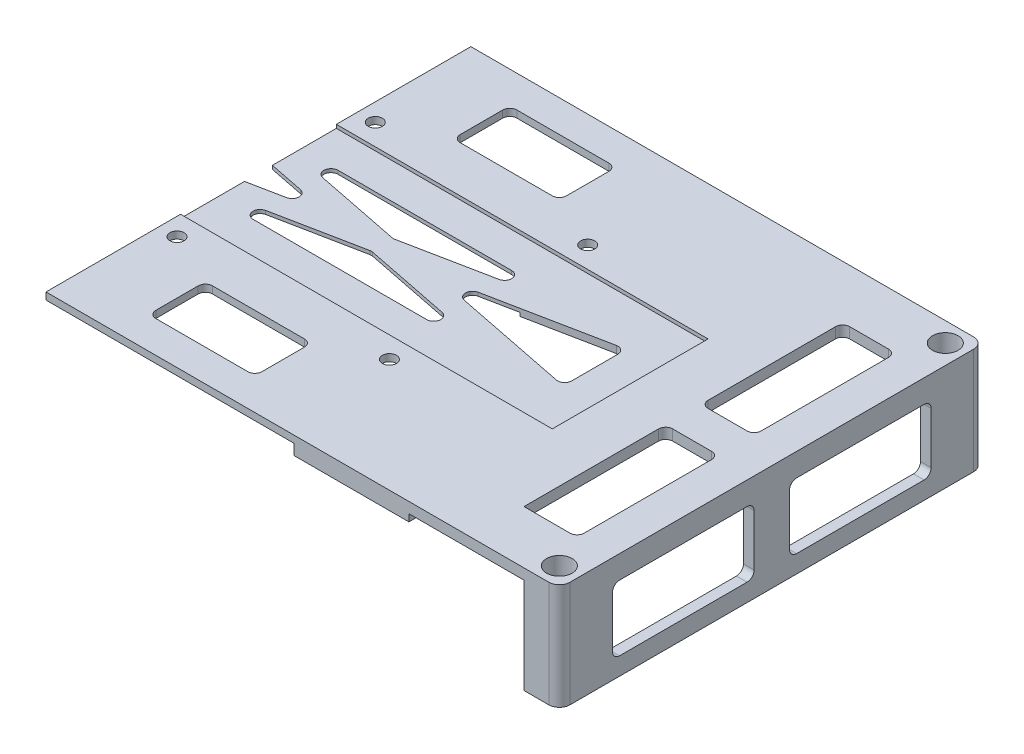
from build123d import *

# Parameters (mm, degrees)
SKETCH_8_W                = 220
SKETCH_8_H                = 120
EXTRUDE_6_DEPTH           = 3
SKETCH_10_W               = 10
SKETCH_10_H               = 120
EXTRUDE_7_DEPTH           = 27
CUT_EXTRUDE_1_DEPTH       = 129.175660716
CUT_EXTRUDE_1_DEPTH_BACK  = 129.175660716
SKETCH_9_R                = 2.05
SKETCH_11_R               = 3.6
CUT_EXTRUDE_2_DEPTH       = 22
CUT_EXTRUDE_4_DEPTH       = 129.175660716
CUT_EXTRUDE_4_DEPTH_BACK  = 129.175660716
SKETCH_13_W               = 40
SKETCH_13_H               = 18.5
SKETCH_14_W               = 140
SKETCH_14_H               = 44
CUT_EXTRUDE_7_DEPTH       = 1
SKETCH_15_W               = 15
SKETCH_15_H               = 80
SKETCH_15_H_2             = 40
SKETCH_15_W_2             = 30
SKETCH_15_H_3             = 16
CUT_EXTRUDE_8_DEPTH       = 129.840987267
SKETCH_9_5_R              = 2
CUT_EXTRUDE_9_DEPTH       = 129.175660716
CUT_EXTRUDE_13_DEPTH      = 27
SKETCH_20_W               = 135
SKETCH_20_H               = 8
EXTRUDE_8_DEPTH           = 2
FILLET_1_R                = 3
FILLET_2_R                = 2
CUT_EXTRUDE_14_DEPTH      = 129.175660716
CUT_EXTRUDE_14_DEPTH_BACK = 129.175660716


with BuildPart() as part:
    # 草圖8 → 填料-伸長6 (new body)
    with BuildSketch(Plane(origin=(0, 0, 0), x_dir=(1, 0, 0), z_dir=(0, 1, 0))):
        Rectangle(SKETCH_8_W, SKETCH_8_H)
    extrude(amount=EXTRUDE_6_DEPTH)

    # 草圖10 → 填料-伸長7 (add)
    with BuildSketch(Plane.XZ):
        with Locations((-105, 0)):
            Rectangle(SKETCH_10_W, SKETCH_10_H)
        with Locations((105, 0)):
            Rectangle(SKETCH_10_W, SKETCH_10_H)
    extrude(amount=EXTRUDE_7_DEPTH)

    # 草圖9 → 除料-伸長1 (cut, two sides: drawn at the far end of the back side and taken through both)
    with BuildSketch(Plane(origin=(0, 0, 0), x_dir=(1, 0, 0), z_dir=(0, 1, 0)).offset(-CUT_EXTRUDE_1_DEPTH_BACK)):
        with Locations((104.5, 54.5)):
            Circle(SKETCH_9_R)
        with Locations((-104.5, 54.5)):
            Circle(SKETCH_9_R)
        with Locations((-104.5, -54.5)):
            Circle(SKETCH_9_R)
        with Locations((104.5, -54.5)):
            Circle(SKETCH_9_R)
    extrude(amount=CUT_EXTRUDE_1_DEPTH + CUT_EXTRUDE_1_DEPTH_BACK, mode=Mode.SUBTRACT)

    # 草圖11 → 除料-伸長2 (cut)
    with BuildSketch(Plane(origin=(0, 3, 0), x_dir=(1, 0, 0), z_dir=(0, 1, 0))):
        with Locations((-104.497380754, 54.5)):
            Circle(SKETCH_11_R)
        with Locations((-104.497380754, -54.5)):
            Circle(SKETCH_11_R)
        with Locations((104.5, -54.5)):
            Circle(SKETCH_11_R)
        with Locations((104.5, 54.5)):
            Circle(SKETCH_11_R)
    extrude(amount=-CUT_EXTRUDE_2_DEPTH, mode=Mode.SUBTRACT)

    # 草圖13 → 除料-伸長4 (cut, two sides: drawn at the far end of the back side and taken through both)
    with BuildSketch(Plane(origin=(0, 0, 0), x_dir=(0, 0, -1), z_dir=(1, 0, 0)).offset(-CUT_EXTRUDE_4_DEPTH_BACK)):
        with Locations((-25, -12.75)):
            Rectangle(SKETCH_13_W, SKETCH_13_H)
        with Locations((25, -12.75)):
            Rectangle(SKETCH_13_W, SKETCH_13_H)
    extrude(amount=CUT_EXTRUDE_4_DEPTH + CUT_EXTRUDE_4_DEPTH_BACK, mode=Mode.SUBTRACT)

    # 草圖14 → 除料-伸長7 (cut)
    with BuildSketch(Plane(origin=(0, 3, 0), x_dir=(1, 0, 0), z_dir=(0, 1, 0))):
        Rectangle(SKETCH_14_W, SKETCH_14_H)
    extrude(amount=-CUT_EXTRUDE_7_DEPTH, mode=Mode.SUBTRACT)

    # 草圖15 → 除料-伸長8 (cut, through all)
    with BuildSketch(Plane(origin=(0, 3, 0), x_dir=(1, 0, 0), z_dir=(0, 1, 0))):
        with Locations((-92.5, 0)):
            Rectangle(SKETCH_15_W, SKETCH_15_H)
        with Locations((92.5, 25)):
            Rectangle(SKETCH_15_W, SKETCH_15_H_2)
        Polygon((-44.702941459, -12), (44.702941459, -12), (0, -3.059411708), align=None)
        Polygon((-60, -8.940588292), (-60, 8.940588292), (-15.297058541, 0), align=None)
        Polygon((-44.702941459, 12), (44.702941459, 12), (0, 3.059411708), align=None)
        Polygon((60, -8.940588292), (60, 8.940588292), (15.297058541, 0), align=None)
        with Locations((0, -43)):
            Rectangle(SKETCH_15_W_2, SKETCH_15_H_3)
        with Locations((0, 43)):
            Rectangle(SKETCH_15_W_2, SKETCH_15_H_3)
        with Locations((92.5, -25)):
            Rectangle(SKETCH_15_W, SKETCH_15_H_2)
    extrude(amount=-CUT_EXTRUDE_8_DEPTH, mode=Mode.SUBTRACT)

    # 草圖9<5> → 除料-伸長9 (cut, through all)
    with BuildSketch(Plane(origin=(0, 0, 0), x_dir=(1, 0, 0), z_dir=(0, 1, 0))):
        with Locations((30, 28)):
            Circle(SKETCH_9_5_R)
        with Locations((-30, 28)):
            Circle(SKETCH_9_5_R)
        with Locations((30, -28)):
            Circle(SKETCH_9_5_R)
        with Locations((-30, -28)):
            Circle(SKETCH_9_5_R)
    extrude(amount=CUT_EXTRUDE_9_DEPTH, mode=Mode.SUBTRACT)

    # 草圖19 → 除料-伸長13 (cut)
    with BuildSketch(Plane.XZ.offset(27)):
        with BuildLine():
            Line((-100, 54.5), (-100, -54.5))
            ThreePointArc((-100, -54.5), (-101.318019485, -51.318019485), (-104.5, -50))
            Line((-104.5, -50), (-107, -50))
            Line((-107, -50), (-107, 50))
            Line((-107, 50), (-104.5, 50))
            ThreePointArc((-104.5, 50), (-101.318019485, 51.318019485), (-100, 54.5))
        make_face()
        with BuildLine():
            Line((100, 54.5), (100, -54.5))
            ThreePointArc((100, -54.5), (101.318019485, -51.318019485), (104.5, -50))
            Line((104.5, -50), (107, -50))
            Line((107, -50), (107, 50))
            Line((107, 50), (104.5, 50))
            ThreePointArc((104.5, 50), (101.318019485, 51.318019485), (100, 54.5))
        make_face()
    extrude(amount=-CUT_EXTRUDE_13_DEPTH, mode=Mode.SUBTRACT)

    # 草圖20 → 填料-伸長8 (add)
    with BuildSketch(Plane.XZ):
        with Locations((0, 56)):
            Rectangle(SKETCH_20_W, SKETCH_20_H)
        with Locations((0, -56)):
            Rectangle(SKETCH_20_W, SKETCH_20_H)
        Polygon((-59, 32.5), (-39, 32.5), (-39, 29.5), (-54, 29.5), (-54, 25), (-59, 25), align=None)
        Polygon((54, 29.5), (39, 29.5), (39, 32.5), (59, 32.5), (59, 25), (54, 25), align=None)
        Polygon((59, -32.5), (39, -32.5), (39, -29.5), (54, -29.5), (54, -25), (59, -25), align=None)
        Polygon((-54, -29.5), (-39, -29.5), (-39, -32.5), (-59, -32.5), (-59, -25), (-54, -25), align=None)
    extrude(amount=EXTRUDE_8_DEPTH)

    # 圓角1
    fillet_1_edges = [part.edges().sort_by_distance(p)[0] for p in [
        (-110, -12, 60),
        (-110, -12, -60),
        (110, -12, -60),
        (110, -12, 60),
    ]]
    fillet(fillet_1_edges, radius=FILLET_1_R)

    # 圓角2
    fillet_2_edges = [part.edges().sort_by_distance(p)[0] for p in [
        (-107, 0, 0),
        (107, 0, 0),
        (108.5, -3.5, -5),
        (108.5, -3.5, 45),
        (108.5, -22, 45),
        (108.5, -22, -5),
        (108.5, -3.5, -45),
        (108.5, -3.5, 5),
        (108.5, -22, 5),
        (108.5, -22, -45),
        (-108.5, -22, -45),
        (-108.5, -22, 5),
        (-108.5, -3.5, -45),
        (-108.5, -3.5, 5),
        (-108.5, -22, 45),
        (-108.5, -3.5, 45),
        (-108.5, -3.5, -5),
        (-108.5, -22, -5),
        (60, 1, -8.940588292),
        (44.702941459, 1, -12),
        (-44.702941459, 1, -12),
        (0, 1, 3.059411708),
        (-44.702941459, 1, 12),
        (44.702941459, 1, 12),
        (-15.297058541, 1, 0),
        (0, 1, -3.059411708),
        (60, 1, 8.940588292),
        (100, 1.5, -5),
        (15, 1.5, -35),
        (100, 1.5, 45),
        (15, 1.5, 51),
        (-85, 1.5, 40),
        (-15, 1.5, 51),
        (85, 1.5, -5),
        (15.297058541, 1, 0),
        (-100, 1.5, 40),
        (-15, 1.5, -35),
        (-60, 1, 8.940588292),
        (-60, 1, -8.940588292),
        (15, 1.5, 35),
        (-15, 1.5, 35),
        (85, 1.5, 5),
        (85, 1.5, -45),
        (100, 1.5, 5),
        (100, 1.5, -45),
        (15, 1.5, -51),
        (-15, 1.5, -51),
        (-85, 1.5, -40),
        (-100, 1.5, -40),
    ]]
    fillet(fillet_2_edges, radius=FILLET_2_R)

    # 草圖21 → 除料-伸長14 (cut, two sides: drawn at the far end of the back side and taken through both)
    with BuildSketch(Plane.XY.offset(-CUT_EXTRUDE_14_DEPTH_BACK)):
        Polygon((-35, 3), (-35, 1), (35, 1), (35, -27), (-110, -27), (-110, 3), align=None)
    extrude(amount=CUT_EXTRUDE_14_DEPTH + CUT_EXTRUDE_14_DEPTH_BACK, mode=Mode.SUBTRACT)


solid = part.part
